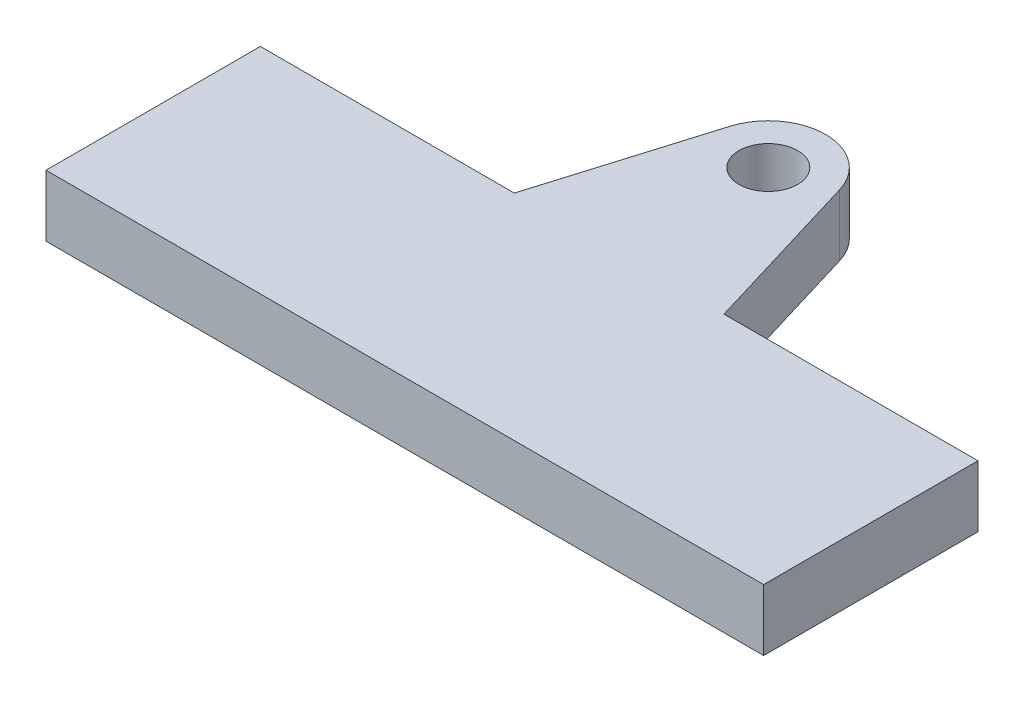
from build123d import *

# Parameters (mm, degrees)
SKETCH_1_R      = 3.15
SKETCH_1_W      = 77
SKETCH_1_H      = 23
EXTRUDE_1_DEPTH = 6.6


with BuildPart() as part:
    # 草图1 → 凸台-拉伸1 (new body)
    # profile 1 of 2: a face of its own
    with BuildSketch(Plane(origin=(0, 0, 0), x_dir=(1, 0, 0), z_dir=(0, 1, 0))):
        with BuildLine():
            Line((-5.888001359, 17.775933557), (-11.249562098, 0))
            Line((-11.249562098, 0), (11.249562098, 0))
            Line((11.249562098, 0), (5.888001359, 17.775933557))
            ThreePointArc((5.888001359, 17.775933557), (0, 22.15), (-5.888001359, 17.775933557))
        make_face()
        with Locations(Location((0, 16, 0), (0, 0, 270))):
            Circle(SKETCH_1_R, mode=Mode.SUBTRACT)
    # profile 2 of 2: a face of its own
    with BuildSketch(Plane(origin=(0, 0, 0), x_dir=(1, 0, 0), z_dir=(0, 1, 0))):
        with Locations((0, -11.5)):
            Rectangle(SKETCH_1_W, SKETCH_1_H)
    extrude(amount=EXTRUDE_1_DEPTH)


solid = part.part
